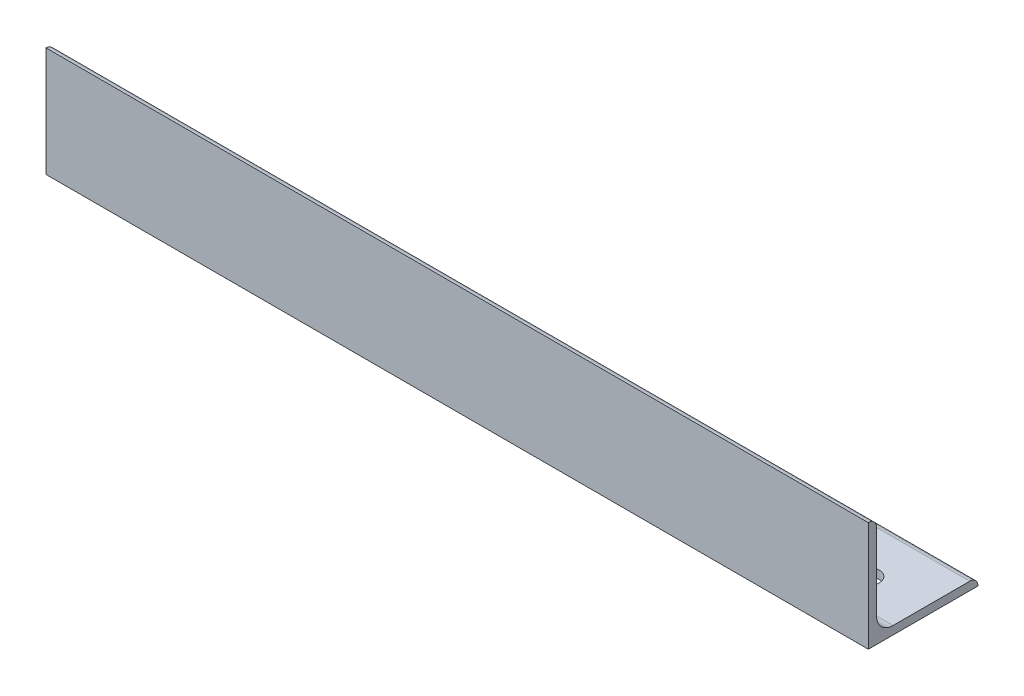
from build123d import *

# Parameters (mm, degrees)
L_ANGLE_EQUAL_40X40X3_3_DEPTH = 300
SKETCH14_R                    = 4
CUT_EXTRUDE1_DEPTH            = 10


with BuildPart() as part:
    # Sketch13 → L angle (equal) 40X40X3(3) (new body)
    with BuildSketch(Plane(origin=(0, 0, 0), x_dir=(0, 0, -1), z_dir=(1, 0, 0))):
        with BuildLine():
            Line((0, 40), (0, 0))
            Line((0, 0), (40, 0))
            ThreePointArc((40, 0), (39.121320344, 2.121320344), (37, 3))
            Line((37, 3), (9, 3))
            ThreePointArc((9, 3), (4.757359313, 4.757359313), (3, 9))
            Line((3, 9), (3, 37))
            ThreePointArc((3, 37), (2.121320344, 39.121320344), (0, 40))
        make_face()
    extrude(amount=L_ANGLE_EQUAL_40X40X3_3_DEPTH)

    # Sketch14 → Cut-Extrude1 (cut)
    with BuildSketch(Plane(origin=(0, 0, 0), x_dir=(-1, 0, 0), z_dir=(0, -1, 0))):
        with Locations(Location((-280, 20, 0), (0, 0, 90))):
            Circle(SKETCH14_R)
        with Locations(Location((-20, 20, 0), (0, 0, 90))):
            Circle(SKETCH14_R)
    extrude(amount=-CUT_EXTRUDE1_DEPTH, mode=Mode.SUBTRACT)


solid = part.part
